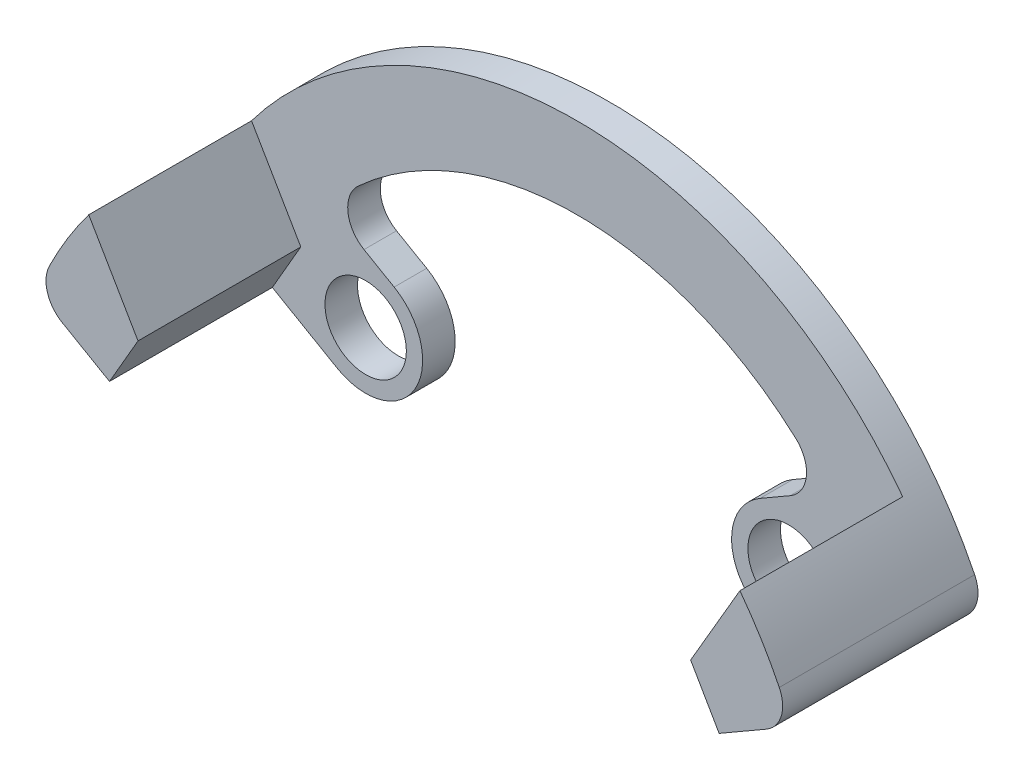
from build123d import *

# Parameters (mm, degrees)
SKETCH1_R           = 1.25
BOSS_EXTRUDE1_DEPTH = 1
BOSS_EXTRUDE2_START = 5
BOSS_EXTRUDE2_DEPTH = 5


with BuildPart() as part:
    # Sketch1 → Boss-Extrude1 (new body)
    with BuildSketch(Plane.XY):
        with BuildLine():
            Line((10.812920647, 4.222556691), (7.37, 2.234785529))
            ThreePointArc((7.37, 2.234785529), (4.979455543, 2.875329985), (5.62, 5.265874442))
            Line((5.62, 5.265874442), (6.546167381, 5.800597429))
            ThreePointArc((6.546167381, 5.800597429), (7.040499888, 6.560307898), (6.717963757, 7.407358703))
            ThreePointArc((6.717963757, 7.407358703), (0, 10), (-6.717963757, 7.407358703))
            ThreePointArc((-6.717963757, 7.407358703), (-7.040499888, 6.560307898), (-6.546167381, 5.800597429))
            Line((-6.546167381, 5.800597429), (-5.62, 5.265874442))
            ThreePointArc((-5.62, 5.265874442), (-4.979455543, 2.875329985), (-7.37, 2.234785529))
            Line((-7.37, 2.234785529), (-10.812920647, 4.222556691))
            ThreePointArc((-10.812920647, 4.222556691), (-11.269892812, 4.798402367), (-11.209696355, 5.531067494))
            ThreePointArc((-11.209696355, 5.531067494), (0, 12.5), (11.209696355, 5.531067494))
            ThreePointArc((11.209696355, 5.531067494), (11.269892812, 4.798402367), (10.812920647, 4.222556691))
        make_face()
        with Locations((-6.495, 3.750329985)):
            Circle(SKETCH1_R, mode=Mode.SUBTRACT)
        with Locations((6.495, 3.750329985)):
            Circle(SKETCH1_R, mode=Mode.SUBTRACT)
    extrude(amount=-BOSS_EXTRUDE1_DEPTH)

    # Sketch2 → Boss-Extrude2 (add)
    with BuildSketch(Plane.XY.offset(BOSS_EXTRUDE2_START)):
        with BuildLine():
            Line((9.361858429, 3.384785529), (8.486858429, 4.900329985))
            Line((8.486858429, 4.900329985), (10, 7.5))
            ThreePointArc((10, 7.5), (10.650444999, 6.543548069), (11.209696355, 5.531067494))
            ThreePointArc((11.209696355, 5.531067494), (11.269892812, 4.798402367), (10.812920647, 4.222556691))
            Line((10.812920647, 4.222556691), (9.361858429, 3.384785529))
        make_face()
        with BuildLine():
            Line((-9.361858429, 3.384785529), (-10.812920647, 4.222556691))
            ThreePointArc((-10.812920647, 4.222556691), (-11.269892812, 4.798402367), (-11.209696355, 5.531067494))
            ThreePointArc((-11.209696355, 5.531067494), (-10.650444999, 6.543548069), (-10, 7.5))
            Line((-10, 7.5), (-8.486858429, 4.900329985))
            Line((-8.486858429, 4.900329985), (-9.361858429, 3.384785529))
        make_face()
    extrude(amount=-BOSS_EXTRUDE2_DEPTH)


solid = part.part
